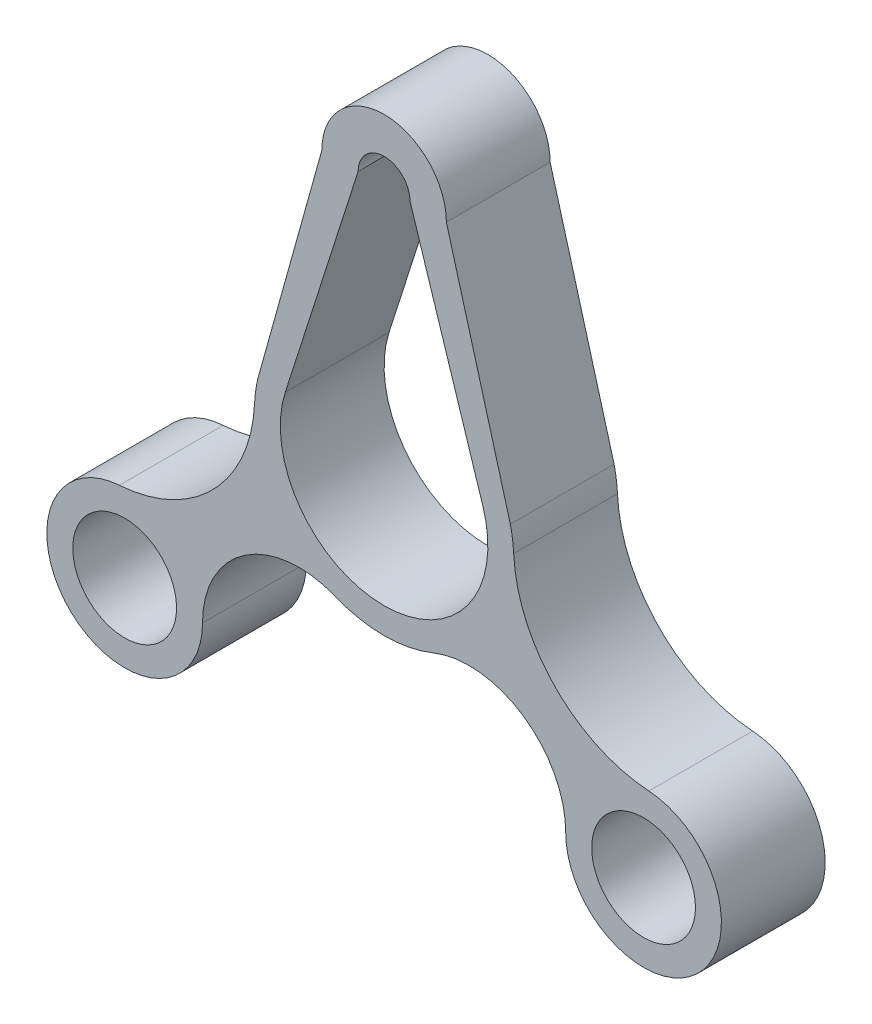
from build123d import *

# Parameters (mm, degrees)
SKETCH1_R           = 10
BOSS_EXTRUDE1_DEPTH = 10


with BuildPart() as part:
    # Sketch1 → Boss-Extrude1 (new, symmetric)
    with BuildSketch(Plane.XY):
        with BuildLine():
            Line((23.804506832, 7.638419634), (12, 50))
            ThreePointArc((12, 50), (0, 62), (-12, 50))
            Line((-12, 50), (-23.804506832, 7.638419634))
            Line((-23.804506832, 7.638419634), (-24.324275855, 5.773179723))
            ThreePointArc((-24.324275855, 5.773179723), (-24.754655731, 3.49385455), (-24.971925744, 1.184451201))
            ThreePointArc((-24.971925744, 1.184451201), (-32.933355329, -17.072864969), (-51.021497025, -25.411515024))
            ThreePointArc((-51.021497025, -25.411515024), (-60.239080638, -51.338500415), (-35, -40.376692732))
            ThreePointArc((-35, -40.376692732), (-26.790738996, -24.957326865), (-9.41500118, -23.1593988))
            ThreePointArc((-9.41500118, -23.1593988), (0, -25), (9.41500118, -23.1593988))
            ThreePointArc((9.41500118, -23.1593988), (26.790738996, -24.957326865), (35, -40.376692732))
            ThreePointArc((35, -40.376692732), (60.239080638, -51.338500415), (51.021497025, -25.411515024))
            ThreePointArc((51.021497025, -25.411515024), (32.933355329, -17.072864969), (24.971925744, 1.184451201))
            ThreePointArc((24.971925744, 1.184451201), (24.754655731, 3.49385455), (24.324275855, 5.773179723))
            Line((24.324275855, 5.773179723), (23.804506832, 7.638419634))
        make_face()
        with Locations((-50, -40.376692732)):
            Circle(SKETCH1_R, mode=Mode.SUBTRACT)
        with Locations((50, -40.376692732)):
            Circle(SKETCH1_R, mode=Mode.SUBTRACT)
        with BuildLine():
            ThreePointArc((-5, 50), (0, 55), (5, 50))
            Line((5, 50), (19.048602886, 6.095139711))
            ThreePointArc((19.048602886, 6.095139711), (0, -20), (-19.048602886, 6.095139711))
            Line((-19.048602886, 6.095139711), (-5, 50))
        make_face(mode=Mode.SUBTRACT)
    extrude(amount=BOSS_EXTRUDE1_DEPTH, both=True)


solid = part.part
